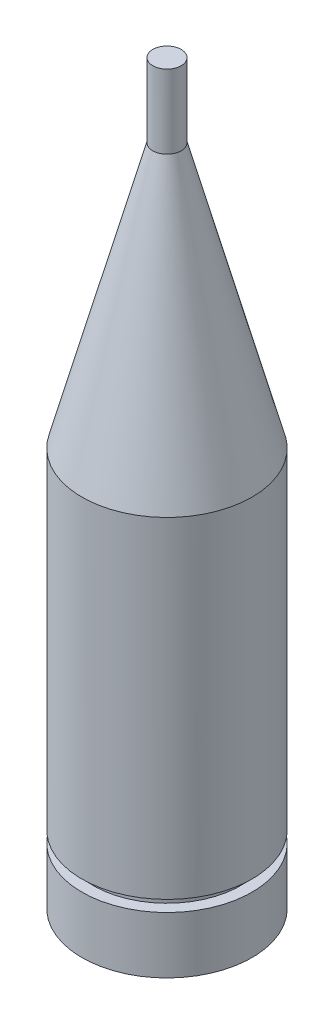
from build123d import *


with BuildPart() as part:
    # Croquis1 → Revolución1 (revolve)
    with BuildSketch(Plane.XY, mode=Mode.PRIVATE) as revoluci_n1_sk:
        Polygon((0, 130), (0, 0), (15, 0), (15, 10), (13, 10), (13, 12), (15, 12), (15, 70.349364905), (2.5, 117), (2.5, 130), align=None)
    revolve(revoluci_n1_sk.sketch.rotate(Axis((0, 130, 0), (0, -1, 0)), 180), axis=Axis((0, 130, 0), (0, -1, 0)))


solid = part.part
